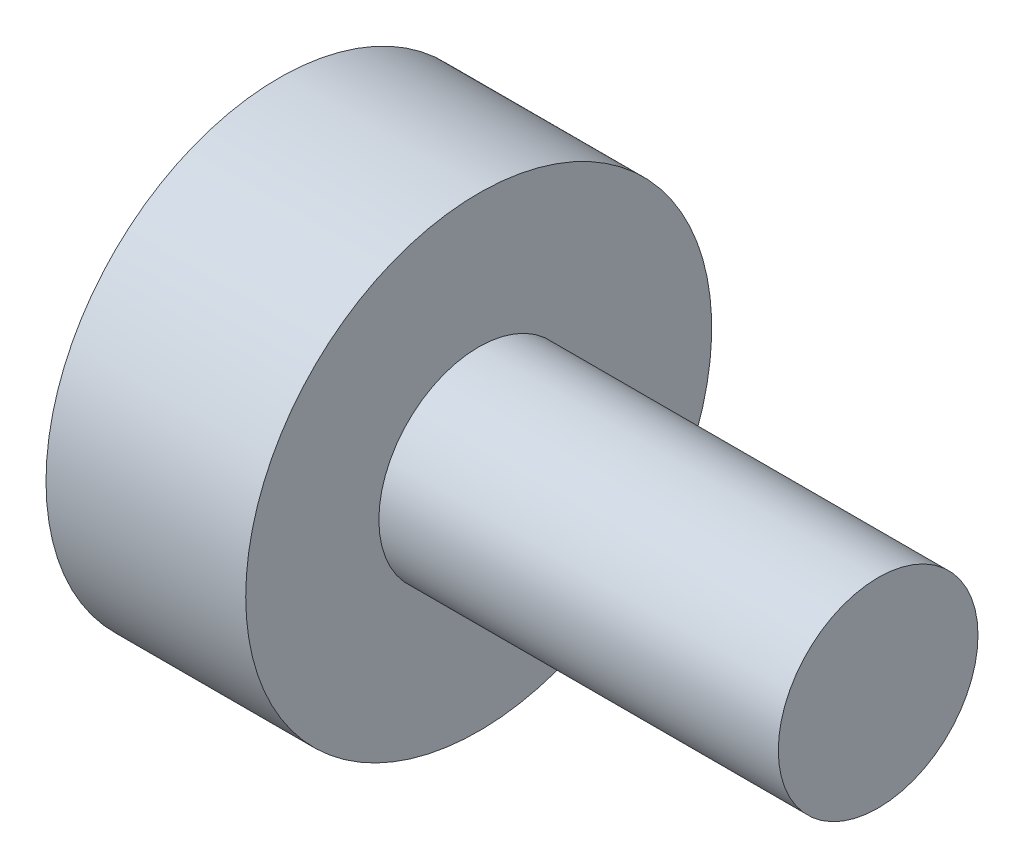
from build123d import *

# Parameters (mm, degrees)
SKETCH_2_R          = 5
CUT_EXTRUDE_1_DEPTH = 20


with BuildPart() as part:
    # Эскиз1 → Повернуть1 (revolve)
    with BuildSketch(Plane.XY, mode=Mode.PRIVATE) as revolve_1_sk:
        Polygon((0, 0), (100, 0), (100, 15), (40, 15), (40, 35), (10, 35), (10, 20), (0, 20), align=None)
    revolve(revolve_1_sk.sketch.rotate(Axis((0, 0, 0), (1, 0, 0)), 90), axis=Axis((0, 0, 0), (1, 0, 0)))

    # Эскиз2 → Вырез-Вытянуть1 (cut)
    with BuildSketch(Plane(origin=(25, 0, 0), x_dir=(0, 0, -1), z_dir=(1, 0, 0))):
        Circle(SKETCH_2_R)
    extrude(amount=CUT_EXTRUDE_1_DEPTH, mode=Mode.SUBTRACT)


solid = part.part
